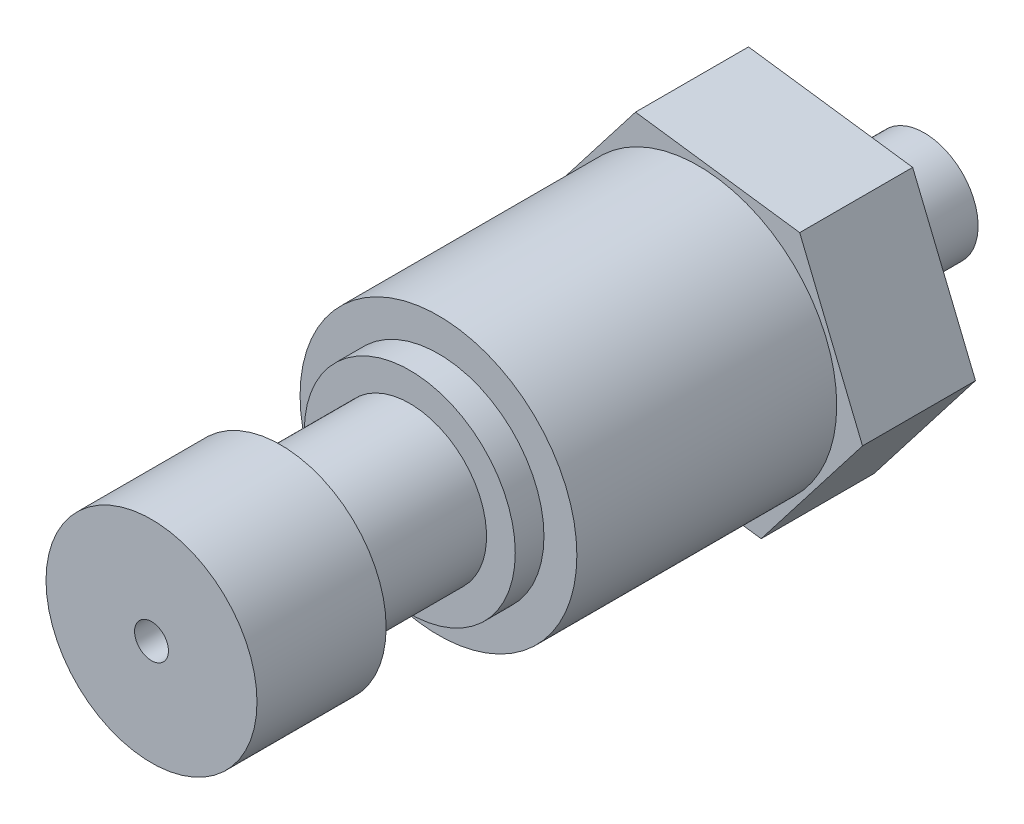
from build123d import *

# Parameters (mm, degrees)
BOSS_EXTRUDE1_DEPTH = 10
SKETCH2_R           = 12.25
BOSS_EXTRUDE2_DEPTH = 23
SKETCH5_R           = 4.7625
BOSS_EXTRUDE3_DEPTH = 10
SKETCH6_R           = 9.337490473
BOSS_EXTRUDE4_DEPTH = 2.54
SKETCH7_R           = 6.793718317
BOSS_EXTRUDE5_DEPTH = 11.43
SKETCH8_R           = 9.337490473
BOSS_EXTRUDE6_DEPTH = 11.43
SKETCH9_R           = 1.5
CUT_EXTRUDE1_DEPTH  = 72.231117539


with BuildPart() as part:
    # Sketch1 → Boss-Extrude1 (new body)
    with BuildSketch(Plane.XY):
        Polygon((14.531817418, -1.969674048), (8.971696472, 11.600086024), (-5.560120947, 13.569760071), (-14.531817418, 1.969674048), (-8.971696472, -11.600086024), (5.560120947, -13.569760071), align=None)
    extrude(amount=BOSS_EXTRUDE1_DEPTH)

    # Sketch2 → Boss-Extrude2 (add)
    with BuildSketch(Plane.XY.offset(10)):
        Circle(SKETCH2_R)
    extrude(amount=BOSS_EXTRUDE2_DEPTH)

    # Sketch5 → Boss-Extrude3 (add)
    with BuildSketch(Plane(origin=(0, 0, 0), x_dir=(-1, 0, 0), z_dir=(0, 0, -1))):
        Circle(SKETCH5_R)
    extrude(amount=BOSS_EXTRUDE3_DEPTH)

    # Sketch6 → Boss-Extrude4 (add)
    with BuildSketch(Plane.XY.offset(33)):
        Circle(SKETCH6_R)
    extrude(amount=BOSS_EXTRUDE4_DEPTH)

    # Sketch7 → Boss-Extrude5 (add)
    with BuildSketch(Plane.XY.offset(35.54)):
        with Locations(Location((0, 0, 0), (0, 0, 180))):
            Circle(SKETCH7_R)
    extrude(amount=BOSS_EXTRUDE5_DEPTH)

    # Sketch8 → Boss-Extrude6 (add)
    with BuildSketch(Plane.XY.offset(46.97)):
        Circle(SKETCH8_R)
    extrude(amount=BOSS_EXTRUDE6_DEPTH)

    # Sketch9 → Cut-Extrude1 (cut, through all)
    with BuildSketch(Plane.XY.offset(58.4)):
        Circle(SKETCH9_R)
    extrude(amount=-CUT_EXTRUDE1_DEPTH, mode=Mode.SUBTRACT)


solid = part.part
